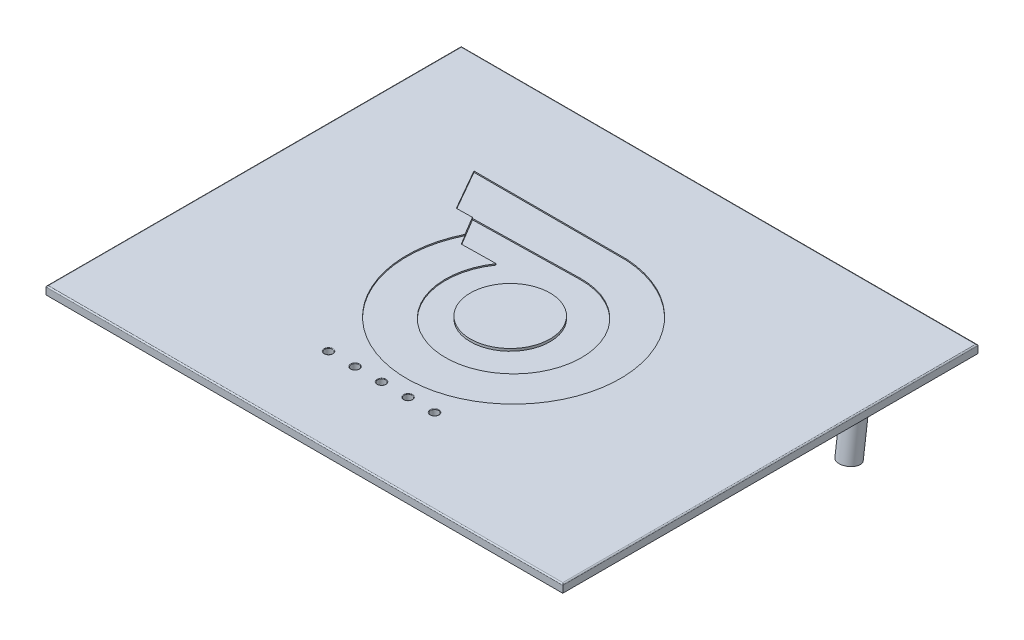
from build123d import *

# Parameters (mm, degrees)
SKETCH1_W                      = 128
SKETCH1_H                      = 101
BOSS_EXTRUDE1_DEPTH            = 2
SKETCH2_W                      = 1.2
SKETCH2_H                      = 98
BOSS_EXTRUDE2_DEPTH            = 1
SKETCH3_W                      = 128
SKETCH3_H                      = 2
BOSS_EXTRUDE3_DEPTH            = 0.48
SKETCH4_W                      = 128
SKETCH4_H                      = 2
BOSS_EXTRUDE4_DEPTH            = 1.37
BOSS_EXTRUDE5_START            = 2
SKETCH5_R                      = 2.5
BOSS_EXTRUDE5_DEPTH            = 13
M3_CLEARANCE_HOLE1_D           = 2.6
M3_CLEARANCE_HOLE1_DEPTH       = 10
M3_CLEARANCE_HOLE1_CSINK_D     = 3
M3_CLEARANCE_HOLE1_CSINK_ANGLE = 90
M3_CLEARANCE_HOLE1_TIP         = 0.781118805
M3_CLEARANCE_HOLE2_D           = 2.6
M3_CLEARANCE_HOLE2_DEPTH       = 10
M3_CLEARANCE_HOLE2_CSINK_D     = 3
M3_CLEARANCE_HOLE2_CSINK_ANGLE = 90
M3_CLEARANCE_HOLE2_TIP         = 0.781118805
SKETCH14_R                     = 1
CUT_EXTRUDE1_DEPTH             = 5
CUT_EXTRUDE2_DEPTH             = 0.4
CUT_EXTRUDE4_DEPTH             = 0.3
CUT_EXTRUDE5_DEPTH             = 0.6
SKETCH30_R                     = 9.871633986
BOSS_EXTRUDE13_DEPTH           = 0.6
FILLET1_R                      = 0.3
FILLET2_R                      = 0.12


with BuildPart() as part:
    # Sketch1 → Boss-Extrude1 (new body)
    with BuildSketch(Plane(origin=(0, 0, 0), x_dir=(1, 0, 0), z_dir=(0, 1, 0))):
        Rectangle(SKETCH1_W, SKETCH1_H)
    extrude(amount=BOSS_EXTRUDE1_DEPTH)

    # Sketch2 → Boss-Extrude2 (add)
    with BuildSketch(Plane.XZ):
        with Locations((62.3, 0)):
            Rectangle(SKETCH2_W, SKETCH2_H)
        with Locations((-62.3, 0)):
            Rectangle(SKETCH2_W, SKETCH2_H)
    extrude(amount=BOSS_EXTRUDE2_DEPTH)

    # Sketch3 → Boss-Extrude3 (add)
    with BuildSketch(Plane.XY.offset(50.5)):
        with Locations((0, 1)):
            Rectangle(SKETCH3_W, SKETCH3_H)
    extrude(amount=BOSS_EXTRUDE3_DEPTH)

    # Sketch4 → Boss-Extrude4 (add)
    with BuildSketch(Plane(origin=(0, 0, -50.5), x_dir=(-1, 0, 0), z_dir=(0, 0, -1))):
        with Locations((0, 1)):
            Rectangle(SKETCH4_W, SKETCH4_H)
    extrude(amount=BOSS_EXTRUDE4_DEPTH)

    # Sketch5 → Boss-Extrude5 (add)
    with BuildSketch(Plane(origin=(0, -10.49000593, 1.363700771), x_dir=(1, 0, 0), z_dir=(0, 0.9916556173432378, -0.12891523025462098)).offset(BOSS_EXTRUDE5_START)):
        with Locations(Location((-59.478852689, 26.433660117, 0), (0, 0, 152.68023031))):
            Circle(SKETCH5_R)
        with Locations(Location((58.821147316, 26.433660117, 0), (0, 0, 270))):
            Circle(SKETCH5_R)
    extrude(amount=BOSS_EXTRUDE5_DEPTH)

    # M3 Clearance Hole1
    with Locations(Plane(origin=(0, -8.506694695, 1.10587031), x_dir=(1, 0, 0), z_dir=(0, -0.9916556173432378, 0.12891523025462098))):
        with Locations((58.821147316, -26.433660117)):
            CounterSinkHole(M3_CLEARANCE_HOLE1_D / 2, M3_CLEARANCE_HOLE1_CSINK_D / 2, depth=M3_CLEARANCE_HOLE1_DEPTH, counter_sink_angle=M3_CLEARANCE_HOLE1_CSINK_ANGLE)
            with Locations((0, 0, -(M3_CLEARANCE_HOLE1_DEPTH + M3_CLEARANCE_HOLE1_TIP / 2))):  # 118° drill point
                Cone(0, M3_CLEARANCE_HOLE1_D / 2, M3_CLEARANCE_HOLE1_TIP, mode=Mode.SUBTRACT)

    # M3 Clearance Hole2
    with Locations(Plane(origin=(0, -8.506694695, 1.10587031), x_dir=(1, 0, 0), z_dir=(0, -0.9916556173432378, 0.12891523025462098))):
        with Locations((-59.478852689, -26.433660117)):
            CounterSinkHole(M3_CLEARANCE_HOLE2_D / 2, M3_CLEARANCE_HOLE2_CSINK_D / 2, depth=M3_CLEARANCE_HOLE2_DEPTH, counter_sink_angle=M3_CLEARANCE_HOLE2_CSINK_ANGLE)
            with Locations((0, 0, -(M3_CLEARANCE_HOLE2_DEPTH + M3_CLEARANCE_HOLE2_TIP / 2))):  # 118° drill point
                Cone(0, M3_CLEARANCE_HOLE2_D / 2, M3_CLEARANCE_HOLE2_TIP, mode=Mode.SUBTRACT)

    # Sketch14 → Cut-Extrude1 (cut)
    with BuildSketch(Plane.XZ):
        with Locations(Location((-8.372305841, 30.05428165, 0), (0, 0, 270))):
            Circle(SKETCH14_R)
        with Locations(Location((4.754600466, 30.05428165, 0), (0, 0, 270))):
            Circle(SKETCH14_R)
        with Locations(Location((11.318053619, 30.05428165, 0), (0, 0, 270))):
            Circle(SKETCH14_R)
        with Locations(Location((-14.935758995, 30.05428165, 0), (0, 0, 270))):
            Circle(SKETCH14_R)
        with Locations(Location((-1.808852688, 30.05428165, 0), (0, 0, 270))):
            Circle(SKETCH14_R)
    extrude(amount=-CUT_EXTRUDE1_DEPTH, mode=Mode.SUBTRACT)

    # Sketch15 → Cut-Extrude2 (cut)
    with BuildSketch(Plane.XZ):
        Polygon((-16.43147406, 32.05428165), (14.761074601, 32.05428165), (19.761074601, 32.05428165), (19.761074601, 28.05428165), (14.761074601, 28.05428165), (-16.43147406, 28.05428165), (-21.43147406, 28.05428165), (-21.43147406, 32.05428165), align=None)
    extrude(amount=-CUT_EXTRUDE2_DEPTH, mode=Mode.SUBTRACT)

    # Sketch31 → Cut-Extrude4 (cut)
    with BuildSketch(Plane(origin=(0, 2, 0), x_dir=(1, 0, 0), z_dir=(0, 1, 0))):
        with BuildLine():
            Line((-35.589637389, 26.611090632), (2.358171766, 26.611090632))
            ThreePointArc((2.358171766, 26.611090632), (11.389438086, -23.958753128), (-20.168517513, 16.574792334))
            Line((-20.168517513, 16.574792334), (-29.764841633, 16.423494794))
            Line((-29.764841633, 16.423494794), (-35.589637389, 26.611090632))
        make_face()
    extrude(amount=-CUT_EXTRUDE4_DEPTH, mode=Mode.SUBTRACT)

    # Sketch29 → Cut-Extrude5 (cut)
    with BuildSketch(Plane(origin=(0, 2, 0), x_dir=(1, 0, 0), z_dir=(0, 1, 0))):
        with BuildLine():
            Line((-25.889090528, 16.549174918), (0.216418019, 17.068757453))
            ThreePointArc((0.216418019, 17.068757453), (8.636281726, -14.628247298), (-13.255238872, 9.79214461))
            Line((-13.255238872, 9.79214461), (-21.775344713, 9.65781494))
            Line((-21.775344713, 9.65781494), (-25.889090528, 16.549174918))
        make_face()
    extrude(amount=-CUT_EXTRUDE5_DEPTH, mode=Mode.SUBTRACT)

    # Fillet1
    fillet1_edges = [part.edges().sort_by_distance(p)[0] for p in [
        (-64, 2, -0.445),
        (0, 2, 50.98),
        (64, 2, -0.445),
        (0, 2, -51.87),
    ]]
    fillet(fillet1_edges, radius=FILLET1_R)

    # Fillet2
    fillet2_edges = [part.edges().sort_by_distance(p)[0] for p in [
        (-1.808852688, 2, 31.05428165),
        (-14.935758995, 2, 31.05428165),
        (11.318053619, 2, 31.05428165),
        (4.754600466, 2, 31.05428165),
        (-8.372305841, 2, 31.05428165),
        (-8.372305841, 0.4, 31.05428165),
        (4.754600466, 0.4, 31.05428165),
        (11.318053619, 0.4, 31.05428165),
        (-14.935758995, 0.4, 31.05428165),
        (-1.808852688, 0.4, 31.05428165),
    ]]
    fillet(fillet2_edges, radius=FILLET2_R)


with BuildPart() as body_2:
    # Sketch30 → Boss-Extrude13 (new body)
    with BuildSketch(Plane(origin=(0, 2, 0), x_dir=(1, 0, 0), z_dir=(0, 1, 0))):
        with Locations(Location((0, 0, 0), (0, 0, 270))):
            Circle(SKETCH30_R)
    extrude(amount=-BOSS_EXTRUDE13_DEPTH)


solid = Compound([part.part, body_2.part])
